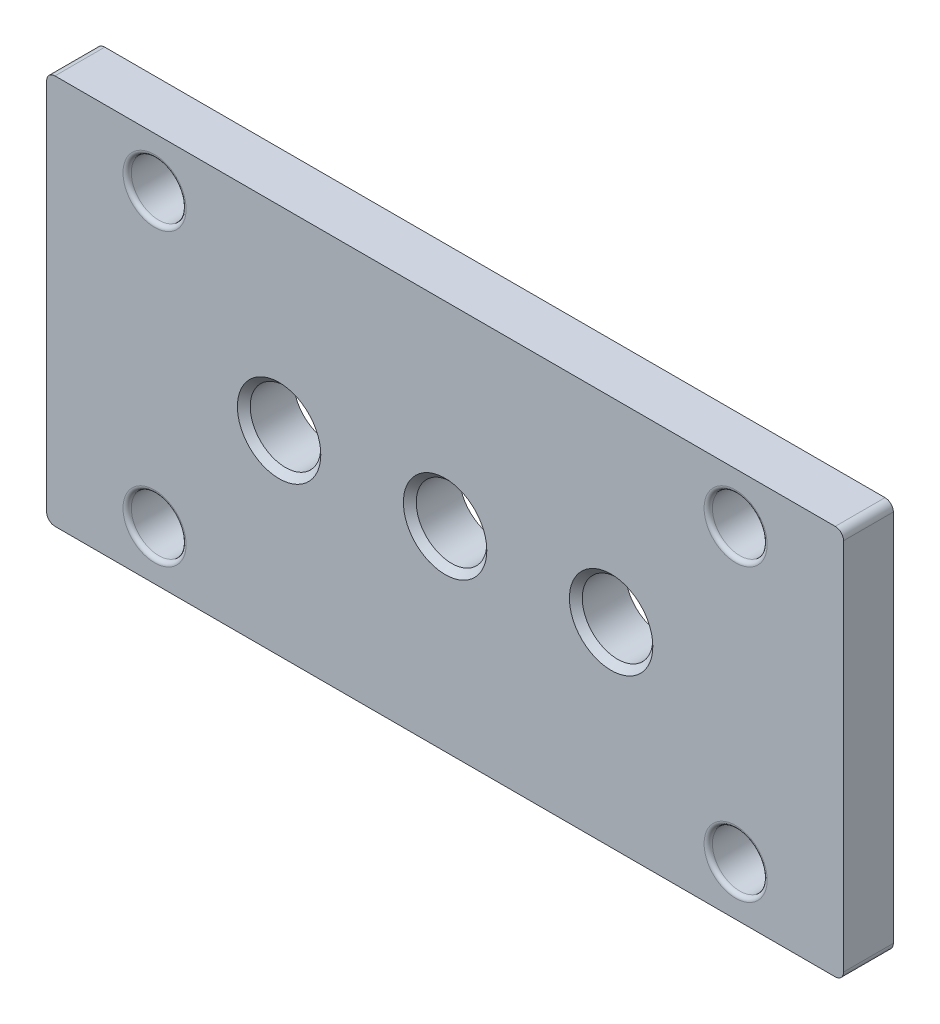
from build123d import *

# Parameters (mm, degrees)
SKETCH_1_W                    = 96
SKETCH_1_H                    = 47
EXTRUDE_1_DEPTH               = 6
FILLET_1_R                    = 1
HOLE_WIZARD_M10_1_D           = 8.5
HOLE_WIZARD_M10_1_CSINK_D     = 10.05
HOLE_WIZARD_M10_1_CSINK_ANGLE = 90
SKETCH_2_R                    = 3.3
CUT_EXTRUDE_1_DEPTH           = 10
FILLET_2_R                    = 0.5


with BuildPart() as part:
    # 草图1 → 凸台-拉伸1 (new body)
    with BuildSketch(Plane.XY):
        with Locations((48, -23.5)):
            Rectangle(SKETCH_1_W, SKETCH_1_H)
    extrude(amount=EXTRUDE_1_DEPTH)

    # 圆角1
    fillet_1_edges = [part.edges().sort_by_distance(p)[0] for p in [
        (0, 0, 3),
        (96, 0, 3),
        (96, -47, 3),
        (0, -47, 3),
    ]]
    fillet(fillet_1_edges, radius=FILLET_1_R)

    # M10 螺纹孔1 (through all)
    with Locations(Plane.XY.offset(6)):
        with Locations((28, -23.5), (48, -23.5), (68, -23.5)):
            CounterSinkHole(HOLE_WIZARD_M10_1_D / 2, HOLE_WIZARD_M10_1_CSINK_D / 2, counter_sink_angle=HOLE_WIZARD_M10_1_CSINK_ANGLE)

    # 草图2 → 切除-拉伸1 (cut)
    with BuildSketch(Plane.XY.offset(6)):
        with Locations((83, -6)):
            Circle(SKETCH_2_R)
        with Locations((83, -41)):
            Circle(SKETCH_2_R)
        with Locations((13, -41)):
            Circle(SKETCH_2_R)
        with Locations(Location((13, -6, 0), (0, 0, 180))):
            Circle(SKETCH_2_R)
    extrude(amount=-CUT_EXTRUDE_1_DEPTH, mode=Mode.SUBTRACT)

    # 圆角2
    fillet_2_edges = [part.edges().sort_by_distance(p)[0] for p in [
        (16.3, -6, 6),
        (9.7, -41, 6),
        (79.7, -41, 6),
        (79.7, -6, 6),
    ]]
    fillet(fillet_2_edges, radius=FILLET_2_R)


solid = part.part
